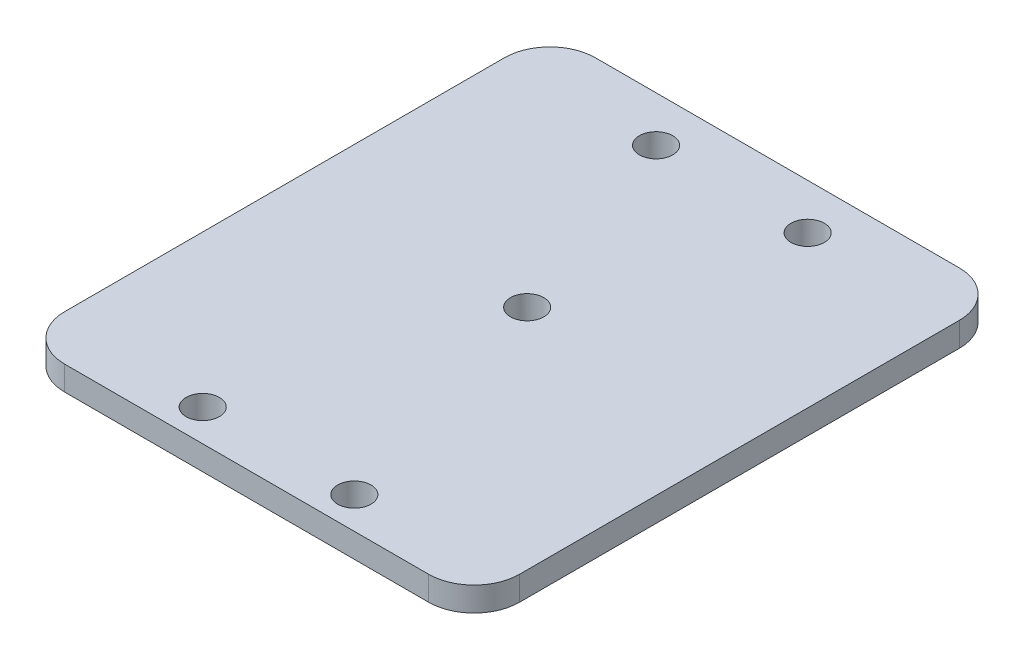
from build123d import *

# Parameters (mm, degrees)
SKETCH1_W                = 30
SKETCH1_H                = 35
BOSS_EXTRUDE1_DEPTH      = 1.6
CUT_EXTRUDE3_DEPTH       = 0.001
M2_CLEARANCE_HOLE1_D     = 2.2
M2_CLEARANCE_HOLE1_DEPTH = 5.2
M2_CLEARANCE_HOLE1_TIP   = 0.660946681
FILLET2_R                = 3


with BuildPart() as part:
    # Sketch1 → Boss-Extrude1 (new body)
    with BuildSketch(Plane(origin=(0, 0, 0), x_dir=(1, 0, 0), z_dir=(0, 1, 0))):
        Rectangle(SKETCH1_W, SKETCH1_H)
    extrude(amount=BOSS_EXTRUDE1_DEPTH)

    # Sketch5 → Cut-Extrude3 (cut)
    with BuildSketch(Plane.XZ):
        with BuildLine():
            Line((7, 17.5), (3, 17.5))
            Line((3, 17.5), (3, 5))
            ThreePointArc((3, 5), (2.267766953, 3.232233047), (0.5, 2.5))
            Line((0.5, 2.5), (-0.5, 2.5))
            ThreePointArc((-0.5, 2.5), (-2.267766953, 3.232233047), (-3, 5))
            Line((-3, 5), (-3, 17.5))
            Line((-3, 17.5), (-7, 17.5))
            Line((-7, 17.5), (-7, -17.5))
            Line((-7, -17.5), (-3, -17.5))
            Line((-3, -17.5), (-3, -7))
            ThreePointArc((-3, -7), (-2.267766953, -5.232233047), (-0.5, -4.5))
            Line((-0.5, -4.5), (0.5, -4.5))
            ThreePointArc((0.5, -4.5), (2.267766953, -5.232233047), (3, -7))
            Line((3, -7), (3, -17.5))
            Line((3, -17.5), (7, -17.5))
            Line((7, -17.5), (7, 17.5))
        make_face()
    extrude(amount=-CUT_EXTRUDE3_DEPTH, mode=Mode.SUBTRACT)

    # M2 Clearance Hole1
    with Locations(Plane(origin=(0, 1.6, 0), x_dir=(1, 0, 0), z_dir=(0, 1, 0))):
        with Locations((-5, 14.5), (-5, -15.4), (5, -15.4), (5, 14.5), (0, 1)):
            Hole(M2_CLEARANCE_HOLE1_D / 2, depth=M2_CLEARANCE_HOLE1_DEPTH)
            with Locations((0, 0, -(M2_CLEARANCE_HOLE1_DEPTH + M2_CLEARANCE_HOLE1_TIP / 2))):  # 118° drill point
                Cone(0, M2_CLEARANCE_HOLE1_D / 2, M2_CLEARANCE_HOLE1_TIP, mode=Mode.SUBTRACT)

    # Fillet2
    fillet2_edges = [part.edges().sort_by_distance(p)[0] for p in [
        (-15, 0.8, -17.5),
        (15, 0.8, -17.5),
        (15, 0.8, 17.5),
        (-15, 0.8, 17.5),
    ]]
    fillet(fillet2_edges, radius=FILLET2_R)


solid = part.part
